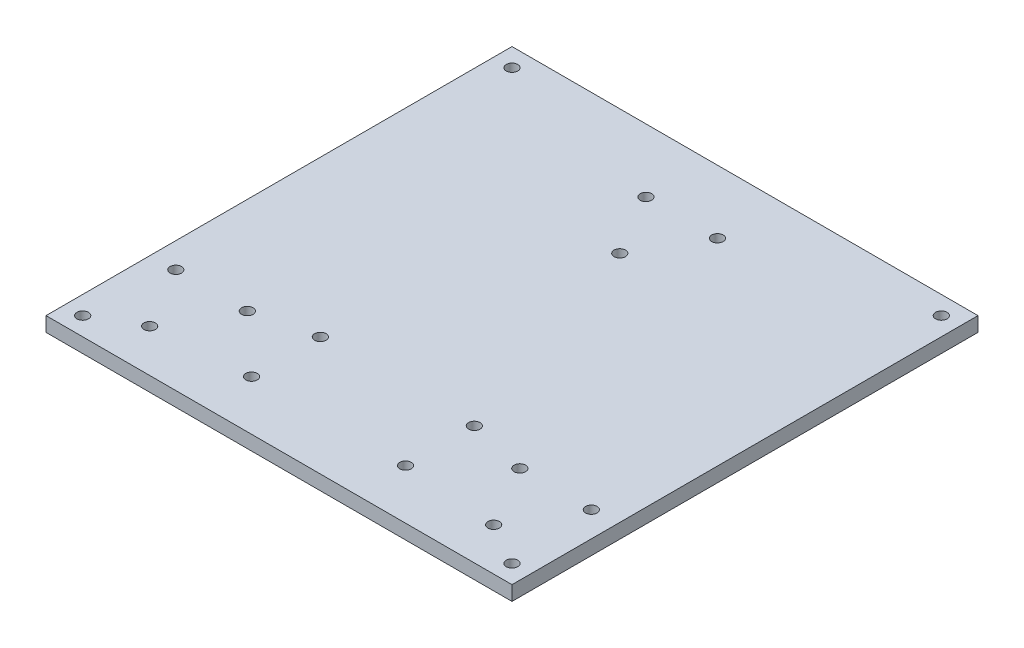
from build123d import *

# Parameters (mm, degrees)
ESQUISSE1_W             = 203.2
ESQUISSE1_H             = 203.2
BOSS_EXTRU_1_DEPTH      = 6.35
ESQUISSE2_R             = 2.5
ENL_V_MAT_EXTRU_1_DEPTH = 144.824345992
ESQUISSE3_R             = 2.5
ENL_V_MAT_EXTRU_2_DEPTH = 144.824345992
ESQUISSE4_R             = 2.5
ENL_V_MAT_EXTRU_3_DEPTH = 144.824345992


with BuildPart() as part:
    # Esquisse1 → Boss.-Extru.1 (new body)
    with BuildSketch(Plane(origin=(0, 0, 0), x_dir=(1, 0, 0), z_dir=(0, 1, 0))):
        Rectangle(ESQUISSE1_W, ESQUISSE1_H)
    extrude(amount=BOSS_EXTRU_1_DEPTH)

    # Esquisse2 → Enlèv. mat.-Extru.1 (cut, through all)
    with BuildSketch(Plane(origin=(0, 6.35, 0), x_dir=(1, 0, 0), z_dir=(0, 1, 0))):
        with Locations(Location((-33.725, -49.85, 0), (0, 0, 270))):
            Circle(ESQUISSE2_R)
        with Locations(Location((-33.725, -79.85, 0), (0, 0, 270))):
            Circle(ESQUISSE2_R)
        with Locations(Location((33.425, -79.85, 0), (0, 0, 270))):
            Circle(ESQUISSE2_R)
        with Locations(Location((33.425, -49.85, 0), (0, 0, 270))):
            Circle(ESQUISSE2_R)
    extrude(amount=-ENL_V_MAT_EXTRU_1_DEPTH, mode=Mode.SUBTRACT)

    # Esquisse3 → Enlèv. mat.-Extru.2 (cut, through all)
    with BuildSketch(Plane(origin=(0, 6.35, 0), x_dir=(1, 0, 0), z_dir=(0, 1, 0))):
        with Locations(Location((-93.6, 93.6, 0), (0, 0, 270))):
            Circle(ESQUISSE3_R)
        with Locations(Location((93.6, 93.6, 0), (0, 0, 270))):
            Circle(ESQUISSE3_R)
        with Locations(Location((93.6, -93.6, 0), (0, 0, 270))):
            Circle(ESQUISSE3_R)
        with Locations(Location((-93.6, -93.6, 0), (0, 0, 270))):
            Circle(ESQUISSE3_R)
    extrude(amount=-ENL_V_MAT_EXTRU_2_DEPTH, mode=Mode.SUBTRACT)

    # Esquisse4 → Enlèv. mat.-Extru.3 (cut, through all)
    with BuildSketch(Plane(origin=(0, 6.35, 0), x_dir=(1, 0, 0), z_dir=(0, 1, 0))):
        with Locations(Location((-15.588457268, 74, 0), (0, 0, 270))):
            Circle(ESQUISSE4_R)
        with Locations(Location((15.588457268, 74, 0), (0, 0, 270))):
            Circle(ESQUISSE4_R)
        with Locations(Location((0, 47, 0), (0, 0, 270))):
            Circle(ESQUISSE4_R)
        with Locations(Location((-75, -83, 0), (0, 0, 270))):
            Circle(ESQUISSE4_R)
        with Locations(Location((-90.588457268, -56, 0), (0, 0, 270))):
            Circle(ESQUISSE4_R)
        with Locations(Location((-59.411542732, -56, 0), (0, 0, 270))):
            Circle(ESQUISSE4_R)
        with Locations(Location((59.411542732, -56, 0), (0, 0, 270))):
            Circle(ESQUISSE4_R)
        with Locations(Location((90.588457268, -56, 0), (0, 0, 270))):
            Circle(ESQUISSE4_R)
        with Locations(Location((75, -83, 0), (0, 0, 270))):
            Circle(ESQUISSE4_R)
    extrude(amount=-ENL_V_MAT_EXTRU_3_DEPTH, mode=Mode.SUBTRACT)


solid = part.part
